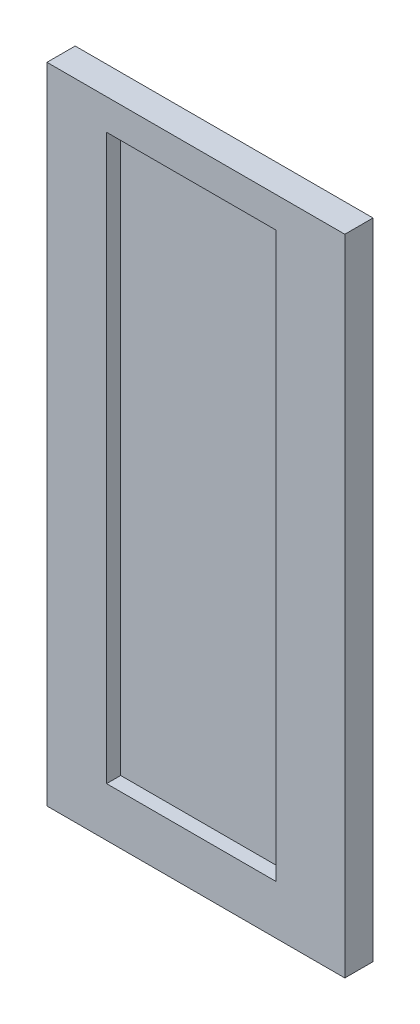
from build123d import *

# Parameters (mm, degrees)
SKETCH_1_W          = 52.799805542
SKETCH_1_H          = 114.181900438
EXTRUDE_1_DEPTH     = 5
SKETCH_3_W          = 30
SKETCH_3_H          = 100
CUT_EXTRUDE_2_DEPTH = 2.5


with BuildPart() as part:
    # 草图1 → 凸台-拉伸1 (new body)
    with BuildSketch(Plane.XY):
        with Locations((15.832267066, -51.631584733)):
            Rectangle(SKETCH_1_W, SKETCH_1_H)
    extrude(amount=-EXTRUDE_1_DEPTH)

    # 草图3 → 切除-拉伸2 (cut)
    with BuildSketch(Plane.XY):
        with Locations((15, -50)):
            Rectangle(SKETCH_3_W, SKETCH_3_H)
    extrude(amount=-CUT_EXTRUDE_2_DEPTH, mode=Mode.SUBTRACT)


solid = part.part
